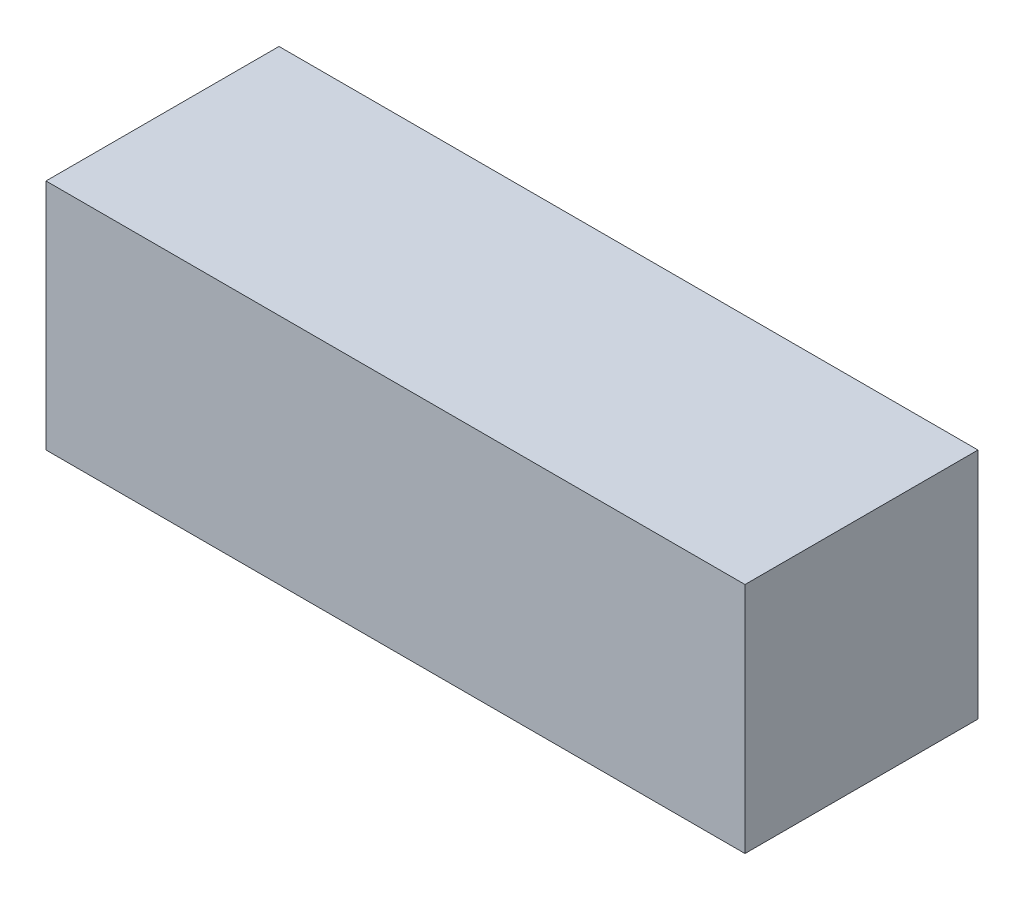
from build123d import *

# Parameters (mm, degrees)
PAYLOAD_STRUCTURE_PROFILE_W  = 300
PAYLOAD_STRUCTURE_PROFILE_H  = 100
PAYLOAD_STRUCTURE_BODY_DEPTH = 100


with BuildPart() as part:
    # Payload Structure Profile → Payload Structure Body (new body)
    with BuildSketch(Plane.XY):
        with Locations((150, 50)):
            Rectangle(PAYLOAD_STRUCTURE_PROFILE_W, PAYLOAD_STRUCTURE_PROFILE_H)
    extrude(amount=PAYLOAD_STRUCTURE_BODY_DEPTH)


solid = part.part
